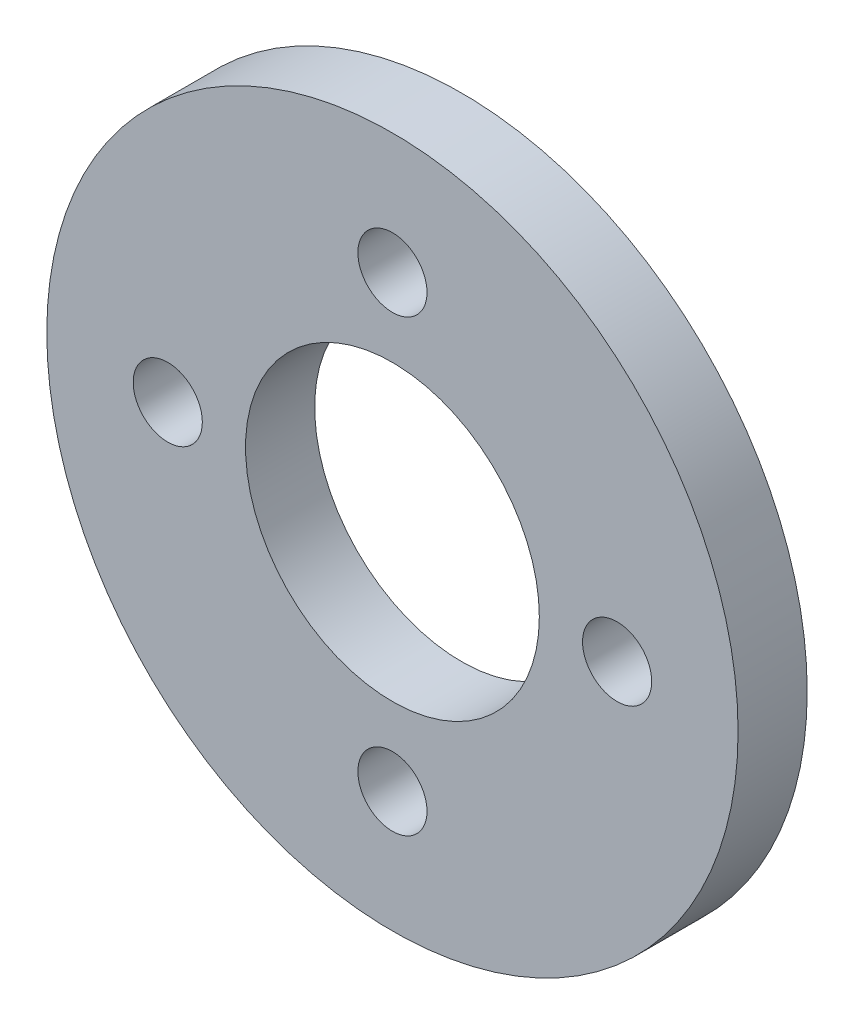
from build123d import *

# Parameters (mm, degrees)
SKETCH1_R           = 10
SKETCH1_R_2         = 4.25
BOSS_EXTRUDE1_DEPTH = 2
SKETCH2_R           = 1
CUT_EXTRUDE1_DEPTH  = 2
CIRPATTERN1_COUNT   = 4


with BuildPart() as part:
    # Sketch1 → Boss-Extrude1 (new body)
    with BuildSketch(Plane.XY):
        Circle(SKETCH1_R)
        Circle(SKETCH1_R_2, mode=Mode.SUBTRACT)
    extrude(amount=BOSS_EXTRUDE1_DEPTH)

    # Sketch2 → Cut-Extrude1 (cut)
    with BuildSketch(Plane.XY.offset(2)):
        with Locations((-6.5, 0)):
            Circle(SKETCH2_R)
    cut_extrude1 = extrude(amount=-CUT_EXTRUDE1_DEPTH, mode=Mode.SUBTRACT)

    # CirPattern1: Cut-Extrude1 ×4 about axis
    cirpattern1_axis = Axis((0, 0, 0), (0, 0, 1))
    for i in range(1, CIRPATTERN1_COUNT):
        add(cut_extrude1.rotate(cirpattern1_axis, i * 360 / CIRPATTERN1_COUNT), mode=Mode.SUBTRACT)


solid = part.part
